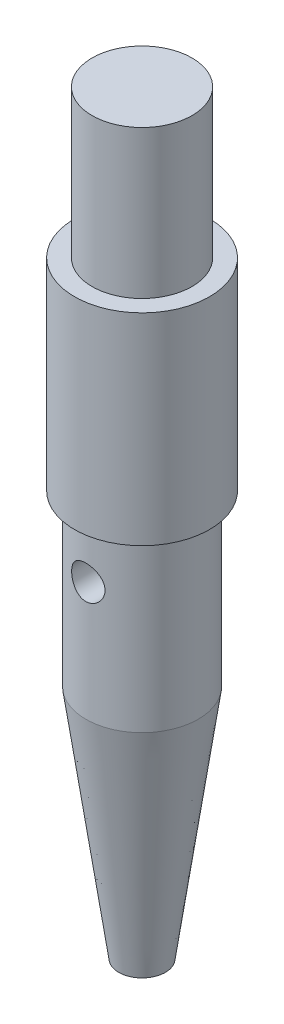
from build123d import *

# Parameters (mm, degrees)
CUT_EXTRUDE1_DEPTH      = 76.475058221
CUT_EXTRUDE1_DEPTH_BACK = 76.475058221
SKETCH2_R               = 1.653940434


with BuildPart() as part:
    # Sketch1 → Revolve1 (revolve)
    with BuildSketch(Plane.XY, mode=Mode.PRIVATE) as revolve1_sk:
        Polygon((0, 0), (4.953, 0), (4.953, -14.6812), (6.6929, -14.6812), (6.6929, -34.671), (5.5753, -34.671), (5.5753, -51.5112), (2.3114, -74.8792), (0, -74.8792), align=None)
    revolve(revolve1_sk.sketch.rotate(Axis((0, -74.8792, 0), (0, 1, 0)), 90), axis=Axis((0, -74.8792, 0), (0, 1, 0)))

    # Sketch2 → Cut-Extrude1 (cut, two sides: drawn at the far end of the back side and taken through both)
    with BuildSketch(Plane.XY.offset(-CUT_EXTRUDE1_DEPTH_BACK)):
        with Locations((0, -39.751)):
            Circle(SKETCH2_R)
    extrude(amount=CUT_EXTRUDE1_DEPTH + CUT_EXTRUDE1_DEPTH_BACK, mode=Mode.SUBTRACT)


solid = part.part
